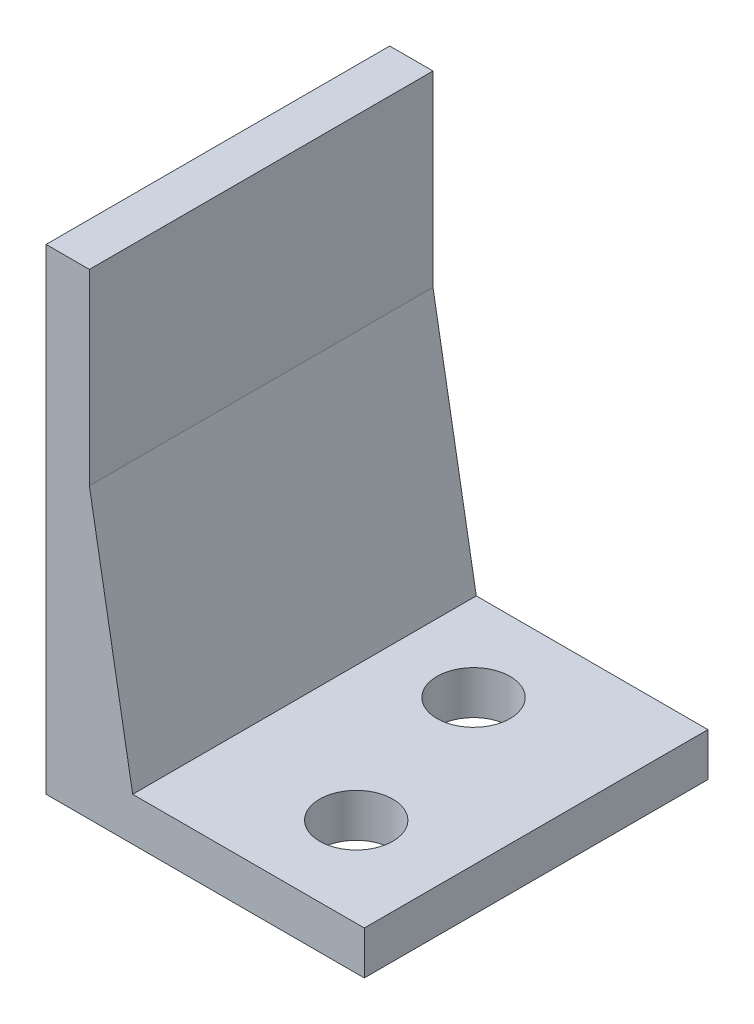
from build123d import *

# Parameters (mm, degrees)
BOSS_EXTRUDE1_DEPTH     = 31.75
F_1_4_CLEARANCE_HOLE1_D = 6.7564
CHAMFER1_SIZE           = 4
CHAMFER1_SIZE2          = 22.685127278


with BuildPart() as part:
    # Sketch1 → Boss-Extrude1 (new body)
    with BuildSketch(Plane.XY):
        Polygon((0, 0), (0, 44), (4, 44), (4, 4), (29.4, 4), (29.4, 0), align=None)
    extrude(amount=BOSS_EXTRUDE1_DEPTH)

    # 1/4 Clearance Hole1 (through all)
    with Locations(Plane(origin=(0, 4, 0), x_dir=(1, 0, 0), z_dir=(0, 1, 0))):
        with Locations((20.4, -23.495), (16, -8.255)):
            Hole(F_1_4_CLEARANCE_HOLE1_D / 2)

    # Chamfer1
    chamfer1_edges = [part.edges().sort_by_distance(p)[0] for p in [
        (4, 4, 15.875),
    ]]
    chamfer1_side = [part.faces().sort_by_distance(p)[0] for p in [
        (16.553612055, 4, 15.875),
    ]]
    chamfer(chamfer1_edges, length=CHAMFER1_SIZE, length2=CHAMFER1_SIZE2, reference=chamfer1_side[0])


solid = part.part
